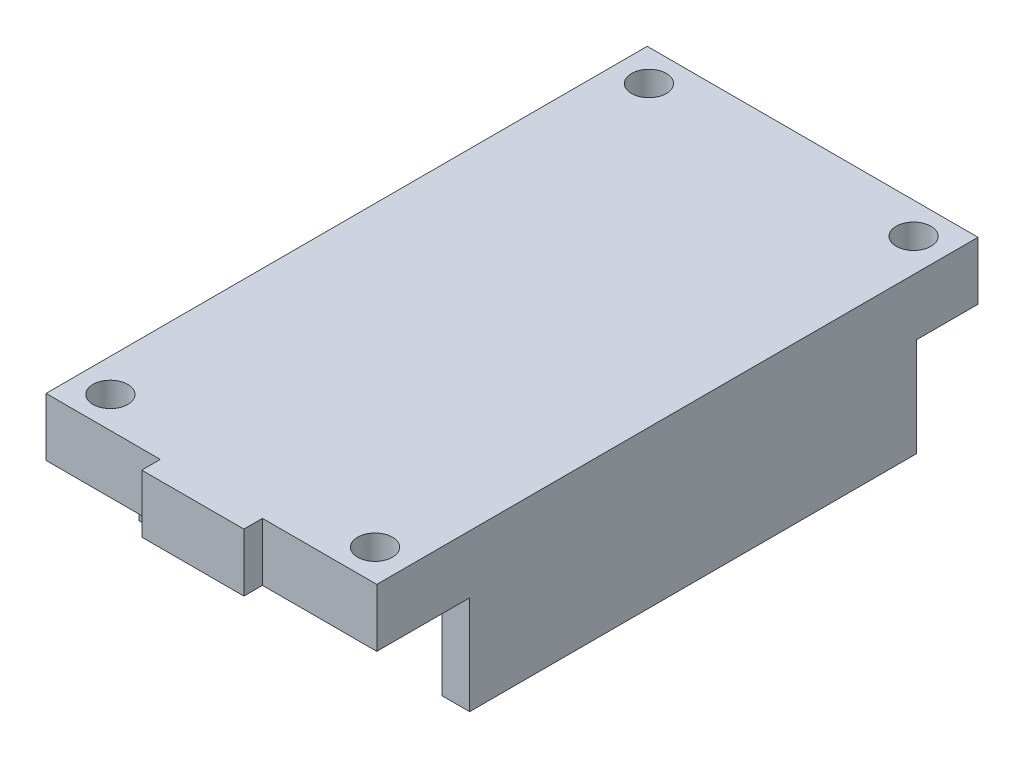
from build123d import *

# Parameters (mm, degrees)
SKETCH1_W           = 28.5
SKETCH1_H           = 51.8
SKETCH1_R           = 1.5
SKETCH1_W_2         = 8.8
SKETCH1_H_2         = 1.6
BOSS_EXTRUDE1_DEPTH = 5
SKETCH2_W           = 2.4
SKETCH2_H           = 38.5
BOSS_EXTRUDE2_DEPTH = 8.5


with BuildPart() as part:
    # Sketch1 → Boss-Extrude1 (new body)
    # profile 1 of 2: a face of its own
    with BuildSketch(Plane(origin=(0, 0, 0), x_dir=(1, 0, 0), z_dir=(0, 1, 0))):
        Rectangle(SKETCH1_W, SKETCH1_H)
        with Locations(Location((-11.4, -23.2, 0), (0, 0, 270))):
            Circle(SKETCH1_R, mode=Mode.SUBTRACT)
        with Locations(Location((11.4, -23.2, 0), (0, 0, 270))):
            Circle(SKETCH1_R, mode=Mode.SUBTRACT)
        with Locations(Location((11.4, 23.2, 0), (0, 0, 270))):
            Circle(SKETCH1_R, mode=Mode.SUBTRACT)
        with Locations(Location((-11.4, 23.2, 0), (0, 0, 270))):
            Circle(SKETCH1_R, mode=Mode.SUBTRACT)
    # profile 2 of 2: a face of its own
    with BuildSketch(Plane(origin=(0, 0, 0), x_dir=(1, 0, 0), z_dir=(0, 1, 0))):
        with Locations((0, -26.7)):
            Rectangle(SKETCH1_W_2, SKETCH1_H_2)
    extrude(amount=BOSS_EXTRUDE1_DEPTH)

    # Sketch2 → Boss-Extrude2 (add)
    with BuildSketch(Plane.XZ):
        with Locations((13.05, -1.35)):
            Rectangle(SKETCH2_W, SKETCH2_H)
        with Locations((-13.05, -1.35)):
            Rectangle(SKETCH2_W, SKETCH2_H)
    extrude(amount=BOSS_EXTRUDE2_DEPTH)


solid = part.part
